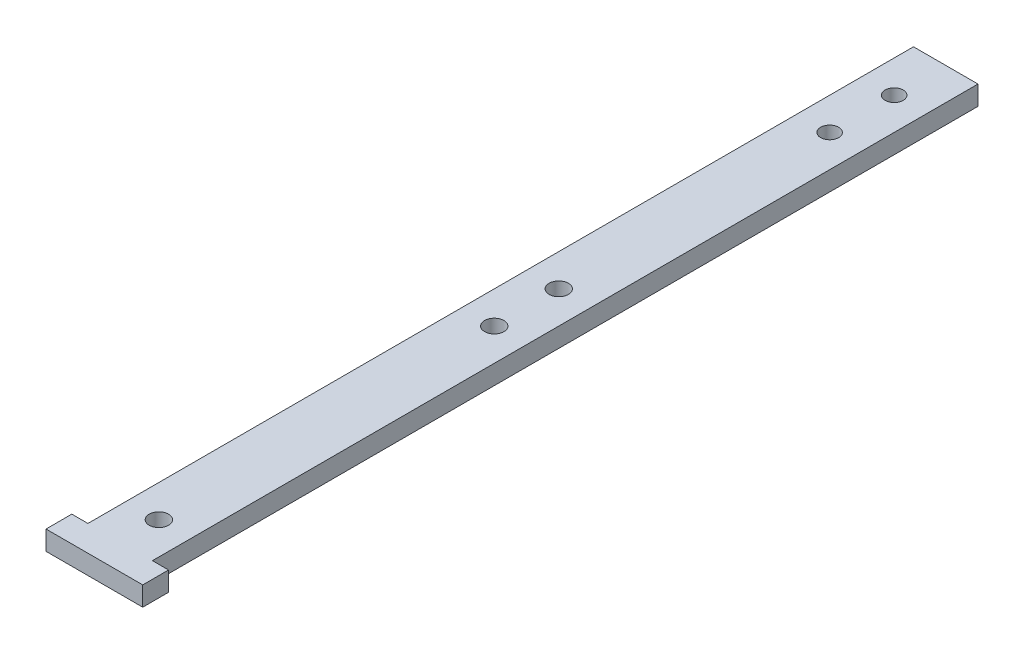
from build123d import *

# Parameters (mm, degrees)
SKETCH1_W           = 15
SKETCH1_H           = 4
SKETCH1_W_2         = 10
SKETCH1_H_2         = 128
SKETCH1_R           = 1.4
SKETCH1_R_2         = 1.5
BOSS_EXTRUDE1_DEPTH = 3


with BuildPart() as part:
    # Sketch1 → Boss-Extrude1 (new body)
    # profile 1 of 2: a face of its own
    with BuildSketch(Plane(origin=(0, 0, 0), x_dir=(1, 0, 0), z_dir=(0, 1, 0))):
        with Locations((42.376726578, -144.989284628)):
            Rectangle(SKETCH1_W, SKETCH1_H)
    # profile 2 of 2: a face of its own
    with BuildSketch(Plane(origin=(0, 0, 0), x_dir=(1, 0, 0), z_dir=(0, 1, 0))):
        with Locations((42.376726578, -78.989284628)):
            Rectangle(SKETCH1_W_2, SKETCH1_H_2)
        with Locations(Location((42.376726578, -22.989284628, 0), (0, 0, 270))):
            Circle(SKETCH1_R, mode=Mode.SUBTRACT)
        with Locations(Location((42.376726578, -32.989284628, 0), (0, 0, 270))):
            Circle(SKETCH1_R, mode=Mode.SUBTRACT)
        with Locations(Location((42.376726578, -136.989284628, 0), (0, 0, 270))):
            Circle(SKETCH1_R_2, mode=Mode.SUBTRACT)
        with Locations(Location((42.376726578, -84.989284628, 0), (0, 0, 270))):
            Circle(SKETCH1_R_2, mode=Mode.SUBTRACT)
        with Locations(Location((42.376726578, -74.989284628, 0), (0, 0, 270))):
            Circle(SKETCH1_R_2, mode=Mode.SUBTRACT)
    extrude(amount=BOSS_EXTRUDE1_DEPTH)


solid = part.part
